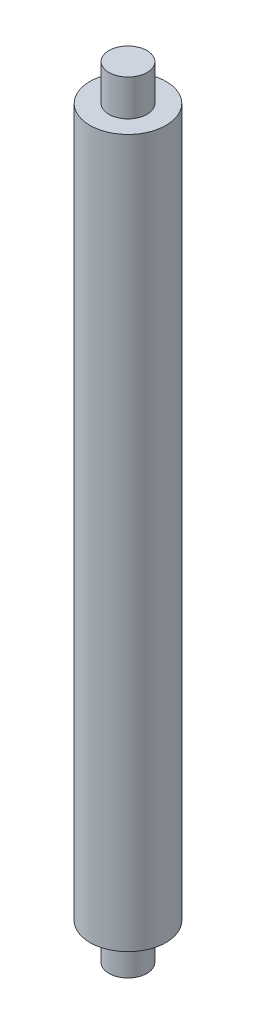
from build123d import *

# Parameters (mm, degrees)
SKETCH1_R           = 5
BOSS_EXTRUDE1_DEPTH = 92.964
SKETCH2_R           = 2.5
BOSS_EXTRUDE2_DEPTH = 4.7625
BOSS_EXTRUDE3_START = 4.7625
SKETCH3_R           = 2.5
BOSS_EXTRUDE3_DEPTH = 4.7625


with BuildPart() as part:
    # Sketch1 → Boss-Extrude1 (new body)
    with BuildSketch(Plane(origin=(0, 0, 0), x_dir=(1, 0, 0), z_dir=(0, 1, 0))):
        with Locations(Location((0, 0, 0), (0, 0, 270))):
            Circle(SKETCH1_R)
    extrude(amount=BOSS_EXTRUDE1_DEPTH)

    # Sketch2 → Boss-Extrude2 (add)
    with BuildSketch(Plane(origin=(0, 92.964, 0), x_dir=(1, 0, 0), z_dir=(0, 1, 0))):
        with Locations(Location((0, 0, 0), (0, 0, 90))):
            Circle(SKETCH2_R)
    extrude(amount=BOSS_EXTRUDE2_DEPTH)

    # Sketch3 → Boss-Extrude3 (add)
    with BuildSketch(Plane.XZ.offset(BOSS_EXTRUDE3_START)):
        with Locations(Location((0, 0, 0), (0, 0, 270))):
            Circle(SKETCH3_R)
    extrude(amount=-BOSS_EXTRUDE3_DEPTH)


solid = part.part
